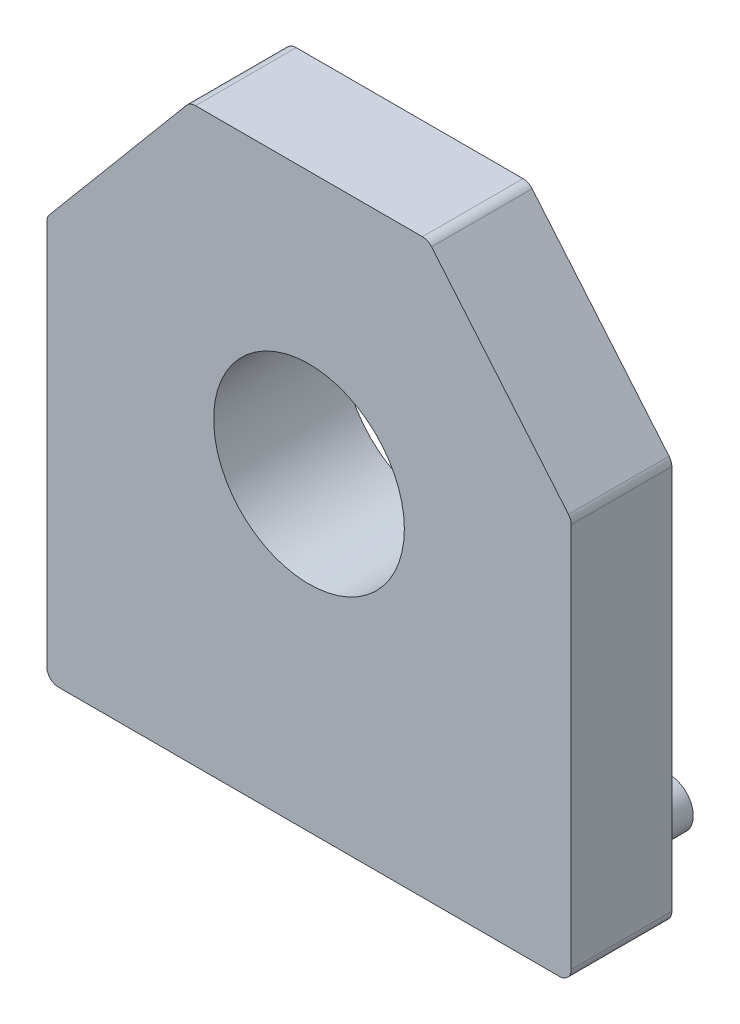
from build123d import *

# Parameters (mm, degrees)
EXTRUSION1_DEPTH = 2.11
CONG_1_R         = 0.25
ESQUISSE2_R      = 2
EXTRUSION2_DEPTH = 17.414996193
ESQUISSE3_R      = 2.5
ESQUISSE3_R_2    = 2
EXTRUSION3_DEPTH = 0.6
ESQUISSE4_R      = 0.5
EXTRUSION4_DEPTH = 1.2


with BuildPart() as part:
    # Esquisse1 → Extrusion1 (new body)
    with BuildSketch(Plane.XY):
        Polygon((0, 8.42), (3.00397668, 12), (7.99602332, 12), (11, 8.42), (11, 0), (0, 0), align=None)
    extrude(amount=EXTRUSION1_DEPTH)

    # Congé1
    cong_1_edges = [part.edges().sort_by_distance(p)[0] for p in [
        (0, 8.42, 1.055),
        (3.00397668, 12, 1.055),
        (7.99602332, 12, 1.055),
        (11, 8.42, 1.055),
        (11, 0, 1.055),
        (0, 0, 1.055),
    ]]
    fillet(cong_1_edges, radius=CONG_1_R)

    # Esquisse2 → Extrusion2 (cut, through all)
    with BuildSketch(Plane.XY.offset(2.11)):
        with Locations((5.5, 6.5)):
            Circle(ESQUISSE2_R)
    extrude(amount=-EXTRUSION2_DEPTH, mode=Mode.SUBTRACT)

    # Esquisse3 → Extrusion3 (add)
    with BuildSketch(Plane(origin=(0, 0, 0), x_dir=(-1, 0, 0), z_dir=(0, 0, -1))):
        with Locations((-5.5, 6.5)):
            Circle(ESQUISSE3_R)
        with Locations(Location((-5.5, 6.5, 0), (0, 0, 180))):
            Circle(ESQUISSE3_R_2, mode=Mode.SUBTRACT)
    extrude(amount=EXTRUSION3_DEPTH)

    # Esquisse4 → Extrusion4 (add)
    with BuildSketch(Plane(origin=(0, 0, 0), x_dir=(-1, 0, 0), z_dir=(0, 0, -1))):
        with Locations((-9.75, 1.01)):
            Circle(ESQUISSE4_R)
        with Locations((-1.25, 1.01)):
            Circle(ESQUISSE4_R)
    extrude(amount=EXTRUSION4_DEPTH)


solid = part.part
